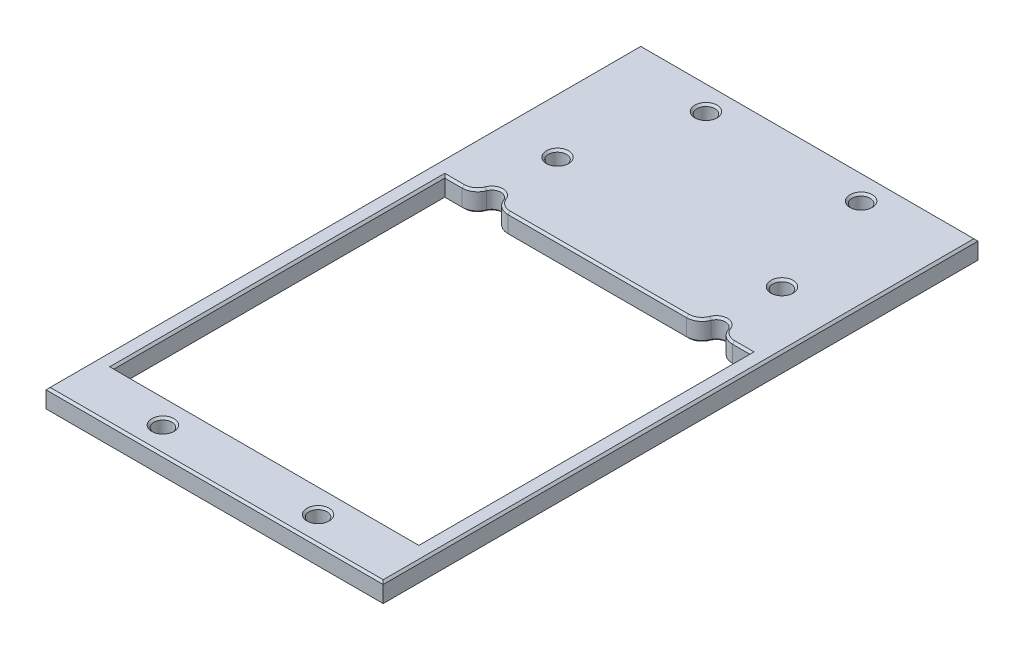
from build123d import *

# Parameters (mm, degrees)
SKETCH1_W           = 65.2
SKETCH1_H           = 115
SKETCH1_R           = 1.75
SKETCH1_W_2         = 59
SKETCH1_H_2         = 64
BOSS_EXTRUDE1_DEPTH = 4
SKETCH2_R           = 1.75
CUT_EXTRUDE1_DEPTH  = 67.219408031
FILLET1_R           = 3
CHAMFER1_SIZE       = 0.4


with BuildPart() as part:
    # Sketch1 → Boss-Extrude1 (new body)
    with BuildSketch(Plane(origin=(0, 0, 0), x_dir=(1, 0, 0), z_dir=(0, 1, 0))):
        Rectangle(SKETCH1_W, SKETCH1_H)
        with Locations(Location((-15, 52.5, 0), (0, 0, 270))):
            Circle(SKETCH1_R, mode=Mode.SUBTRACT)
        with Locations(Location((15, 52.5, 0), (0, 0, 270))):
            Circle(SKETCH1_R, mode=Mode.SUBTRACT)
        with Locations(Location((15, -52.5, 0), (0, 0, 270))):
            Circle(SKETCH1_R, mode=Mode.SUBTRACT)
        with Locations(Location((-15, -52.5, 0), (0, 0, 270))):
            Circle(SKETCH1_R, mode=Mode.SUBTRACT)
        with Locations((0, -15.5)):
            Rectangle(SKETCH1_W_2, SKETCH1_H_2, mode=Mode.SUBTRACT)
    extrude(amount=BOSS_EXTRUDE1_DEPTH)

    # Sketch2 → Cut-Extrude1 (cut, through all)
    with BuildSketch(Plane(origin=(0, 4, 0), x_dir=(1, 0, 0), z_dir=(0, 1, 0))):
        with Locations((-21.7, 17.8)):
            Circle(SKETCH2_R)
        with Locations((21.7, 17.8)):
            Circle(SKETCH2_R)
        with Locations(Location((21.7, 30.5, 0), (0, 0, 270))):
            Circle(SKETCH2_R)
        with Locations(Location((-21.7, 30.5, 0), (0, 0, 270))):
            Circle(SKETCH2_R)
    extrude(amount=-CUT_EXTRUDE1_DEPTH, mode=Mode.SUBTRACT)

    # Fillet1
    fillet1_edges = [part.edges().sort_by_distance(p)[0] for p in [
        (20.528462549, 2, -16.5),
        (22.871537451, 2, -16.5),
        (-22.871537451, 2, -16.5),
        (-20.528462549, 2, -16.5),
    ]]
    fillet(fillet1_edges, radius=FILLET1_R)

    # Chamfer1
    chamfer1_edges = [part.edges().sort_by_distance(p)[0] for p in [
        (32.6, 4, 0),
        (-29.5, 0, 15.5),
        (0, 0, 47.5),
        (29.5, 0, 15.5),
        (27.817684603, 0, -16.5),
        (-29.5, 4, 15.5),
        (0, 4, -57.5),
        (0, 4, 47.5),
        (29.5, 4, 15.5),
        (27.817684603, 4, -16.5),
        (-15, 0, -54.25),
        (-15, 4, -54.25),
        (15, 0, -54.25),
        (15, 4, -54.25),
        (15, 0, 50.75),
        (15, 4, 50.75),
        (-15, 0, 50.75),
        (-15, 4, 50.75),
        (-32.6, 4, 0),
        (0, 0, -57.5),
        (32.6, 0, 0),
        (0, 0, 57.5),
        (-32.6, 0, 0),
        (-21.7, 0, -32.25),
        (-21.7, 4, -32.25),
        (21.7, 0, -32.25),
        (21.7, 4, -32.25),
        (21.7, 4, -19.55),
        (21.7, 0, -19.55),
        (-21.7, 4, -19.55),
        (0, 4, -16.5),
        (-27.817684603, 4, -16.5),
        (-24.435524013, 4, -17.028052121),
        (-18.964475987, 4, -17.028052121),
        (18.964475987, 4, -17.028052121),
        (24.435524013, 4, -17.028052121),
        (0, 0, -16.5),
        (-21.7, 0, -19.55),
        (-27.817684603, 0, -16.5),
        (-24.435524013, 0, -17.028052121),
        (-18.964475987, 0, -17.028052121),
        (18.964475987, 0, -17.028052121),
        (24.435524013, 0, -17.028052121),
        (0, 4, 57.5),
    ]]
    chamfer(chamfer1_edges, length=CHAMFER1_SIZE)


solid = part.part
